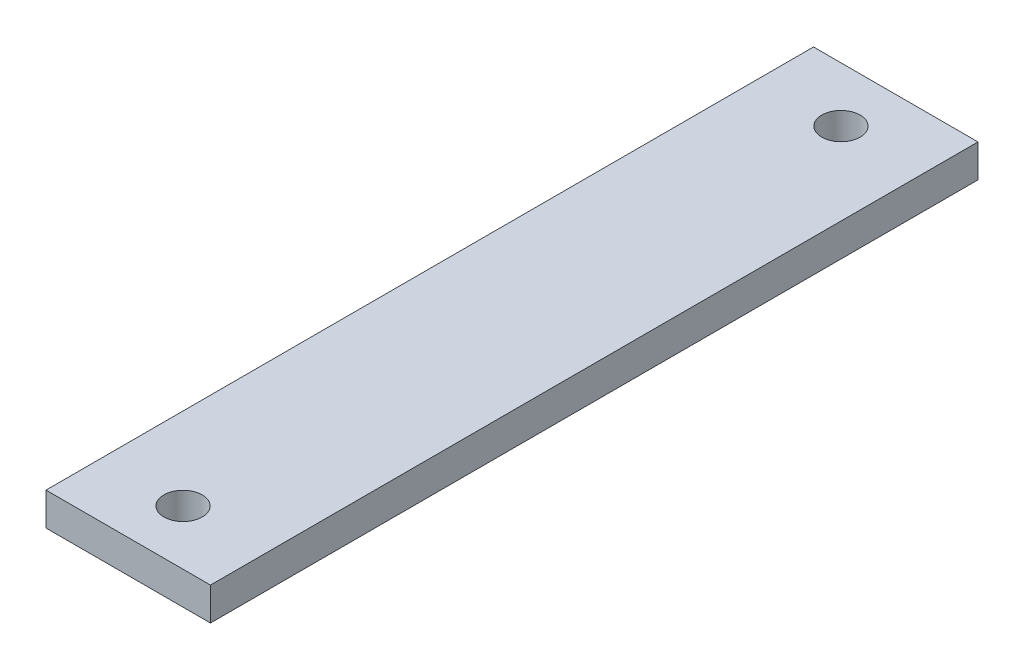
from build123d import *

# Parameters (mm, degrees)
SKETCH1_W           = 15
SKETCH1_H           = 70
SKETCH1_R           = 1.75
BOSS_EXTRUDE1_DEPTH = 3


with BuildPart() as part:
    # Sketch1 → Boss-Extrude1 (new body)
    with BuildSketch(Plane(origin=(0, 0, 0), x_dir=(1, 0, 0), z_dir=(0, 1, 0))):
        with Locations((7.5, 35)):
            Rectangle(SKETCH1_W, SKETCH1_H)
        with Locations(Location((7.5, 5, 0), (0, 0, 270))):
            Circle(SKETCH1_R, mode=Mode.SUBTRACT)
        with Locations(Location((7.5, 65, 0), (0, 0, 90))):
            Circle(SKETCH1_R, mode=Mode.SUBTRACT)
    extrude(amount=BOSS_EXTRUDE1_DEPTH)


solid = part.part
